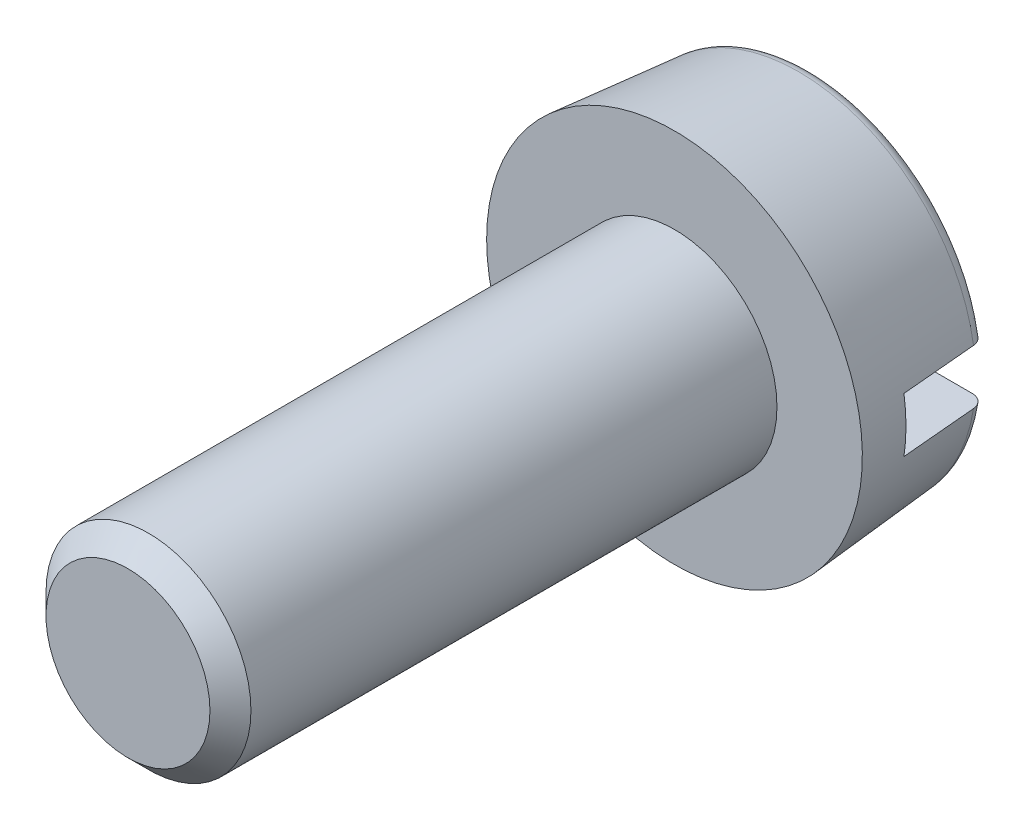
from build123d import *

# Parameters (mm, degrees)
ESQUISSE2_W             = 5.5
ESQUISSE2_H             = 0.8
ENLEV_MAT_EXTRU_1_DEPTH = 1.3
ESQUISSE3_W             = 1.5
ESQUISSE3_H             = 8
CHANFREIN1_SIZE         = 0.3


with BuildPart() as part:
    # Esquisse1 → Base-Révolution (revolve)
    with BuildSketch(Plane(origin=(0, 0, 0), x_dir=(1, 0, 0), z_dir=(0, 1, 0))):
        with BuildLine():
            Line((0, 0), (2.75, 0))
            Line((2.75, 0), (2.590995378, 1.817431149))
            ThreePointArc((2.590995378, 1.817431149), (2.52687448, 1.947455467), (2.391756438, 2))
            Line((2.391756438, 2), (0, 2))
            Line((0, 2), (0, 0))
        make_face()
    revolve(axis=Axis((0, 0, 0), (0, 0, -1)))

    # Esquisse2 → Enlev. mat.-Extru.1 (cut)
    with BuildSketch(Plane.XY.offset(-2)):
        Rectangle(ESQUISSE2_W, ESQUISSE2_H)
    extrude(amount=ENLEV_MAT_EXTRU_1_DEPTH, mode=Mode.SUBTRACT)

    # Esquisse3 → Boss.-Révol.1 (revolve)
    with BuildSketch(Plane(origin=(0, 0, 0), x_dir=(1, 0, 0), z_dir=(0, 1, 0))):
        with Locations((0.75, -4)):
            Rectangle(ESQUISSE3_W, ESQUISSE3_H)
    revolve(axis=Axis((0, 0, 0), (0, 0, 1)))

    # Chanfrein1
    chanfrein1_edges = [part.edges().sort_by_distance(p)[0] for p in [
        (-1.5, 0, 8),
    ]]
    chamfer(chanfrein1_edges, length=CHANFREIN1_SIZE)


solid = part.part
